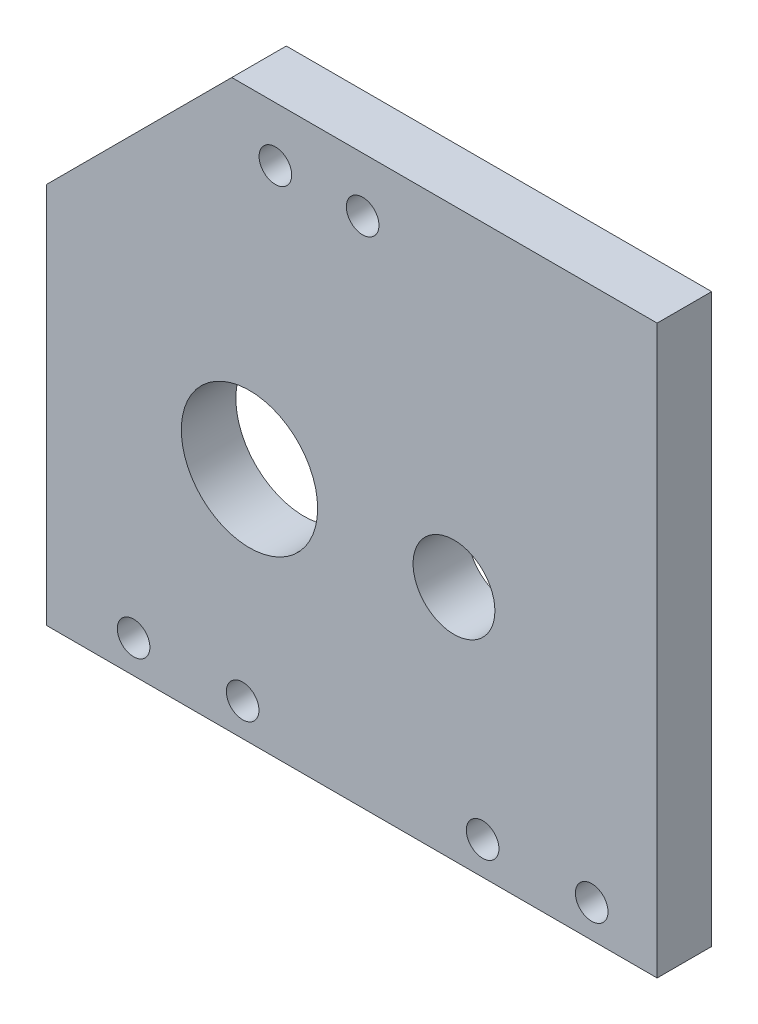
from build123d import *

# Parameters (mm, degrees)
SKETCH1_W             = 71.12
SKETCH1_H             = 66.04
SKETCH1_R             = 7.9375
SKETCH1_R_2           = 4.7625
BOSS_EXTRUDE1_DEPTH   = 6.35
F_6_CLEARANCE_HOLE1_D = 3.7973
CUT_EXTRUDE1_DEPTH    = 49.940336125
F_6_CLEARANCE_HOLE2_D = 3.7973


with BuildPart() as part:
    # Sketch1 → Boss-Extrude1 (new body)
    with BuildSketch(Plane.XY):
        Rectangle(SKETCH1_W, SKETCH1_H)
        with Locations((-11.90625, -5.43814)):
            Circle(SKETCH1_R, mode=Mode.SUBTRACT)
        with Locations((11.90625, -5.43814)):
            Circle(SKETCH1_R_2, mode=Mode.SUBTRACT)
    extrude(amount=BOSS_EXTRUDE1_DEPTH)

    # #6 Clearance Hole1 (through all)
    with Locations(Plane.XY.offset(6.35)):
        with Locations((-25.4, -29.21), (-12.7, -29.21), (15.24, -29.21), (27.94, -29.21)):
            Hole(F_6_CLEARANCE_HOLE1_D / 2)

    # Sketch4 → Cut-Extrude1 (cut, through all)
    with BuildSketch(Plane.XY.offset(6.35)):
        Polygon((-35.56, 11.43), (-35.56, 33.02), (-13.97, 33.02), align=None)
    extrude(amount=-CUT_EXTRUDE1_DEPTH, mode=Mode.SUBTRACT)

    # #6 Clearance Hole2 (through all)
    with Locations(Plane.XY.offset(6.35)):
        with Locations((-8.89, 26.67), (1.27, 26.67)):
            Hole(F_6_CLEARANCE_HOLE2_D / 2)


solid = part.part
